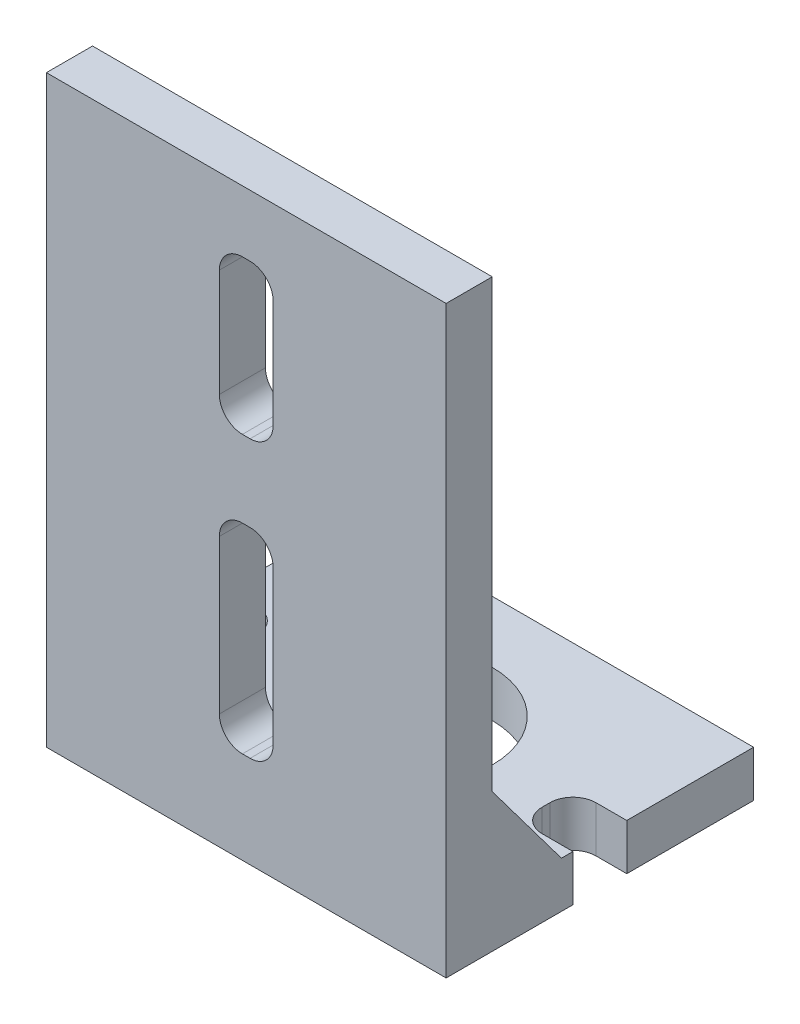
from build123d import *

# Parameters (mm, degrees)
ESBO_O1_W                = 26
ESBO_O1_H                = 20
RESSALTO_EXTRUS_O1_DEPTH = 3
ESBO_O2_W                = 26
ESBO_O2_H                = 3
RESSALTO_EXTRUS_O2_DEPTH = 35
ESBO_O3_W                = 3
ESBO_O3_H                = 4.5
RESSALTO_EXTRUS_O3_DEPTH = 6
CORTE_EXTRUS_O1_DEPTH    = 48.329507785
CORTE_EXTRUS_O2_REACH    = 49.836
ESBO_O5_W                = 3.5
ESBO_O5_H                = 10
ESBO_O5_H_2              = 13
FILETE2_R                = 1.5
FILETE3_R                = 1.5
FILETE4_R                = 1.5
CORTE_EXTRUS_O3_REACH    = 46.815
ESBO_O6_W                = 7
ESBO_O6_H                = 3.5
FILETE5_R                = 1.5
CORTE_EXTRUS_O4_REACH    = 46.815
ESBO_O7_R                = 5.5


with BuildPart() as part:
    # Esboço1 → Ressalto-extrusão1 (new body)
    with BuildSketch(Plane(origin=(0, 0, 0), x_dir=(1, 0, 0), z_dir=(0, 1, 0))):
        with Locations((8.077993659, -0.958207295)):
            Rectangle(ESBO_O1_W, ESBO_O1_H)
    extrude(amount=RESSALTO_EXTRUS_O1_DEPTH)

    # Esboço2 → Ressalto-extrusão2 (add)
    with BuildSketch(Plane(origin=(0, 3, 0), x_dir=(1, 0, 0), z_dir=(0, 1, 0))):
        with Locations((8.077993659, -9.458207295)):
            Rectangle(ESBO_O2_W, ESBO_O2_H)
    extrude(amount=RESSALTO_EXTRUS_O2_DEPTH)

    # Esboço3 → Ressalto-extrusão3 (add)
    with BuildSketch(Plane(origin=(0, 3, 0), x_dir=(1, 0, 0), z_dir=(0, 1, 0))):
        with Locations((19.577993659, -5.708207295)):
            Rectangle(ESBO_O3_W, ESBO_O3_H)
        with Locations((-3.422006341, -5.708207295)):
            Rectangle(ESBO_O3_W, ESBO_O3_H)
    extrude(amount=RESSALTO_EXTRUS_O3_DEPTH)

    # Esboço4 → Corte-extrusão1 (cut, through all)
    with BuildSketch(Plane.ZY.offset(4.922006341)):
        Polygon((3.458207295, 3), (7.958207295, 9), (3.458207295, 9), align=None)
    extrude(amount=-CORTE_EXTRUS_O1_DEPTH, mode=Mode.SUBTRACT)

    # Esboço5 → Corte-extrusão2 (cut, up to next)
    with BuildSketch(Plane.XY.offset(10.958207295), mode=Mode.PRIVATE) as corte_extrus_o2_sk1:
        with Locations((8.077993659, 29)):
            Rectangle(ESBO_O5_W, ESBO_O5_H)
    corte_extrus_o2_tool1 = extrude(corte_extrus_o2_sk1.sketch, amount=-CORTE_EXTRUS_O2_REACH, mode=Mode.PRIVATE) & part.part
    # Esboço5 → Corte-extrusão2 (cut, up to next)
    with BuildSketch(Plane.XY.offset(10.958207295), mode=Mode.PRIVATE) as corte_extrus_o2_sk2:
        with Locations((8.077993659, 12.5)):
            Rectangle(ESBO_O5_W, ESBO_O5_H_2)
    corte_extrus_o2_tool2 = extrude(corte_extrus_o2_sk2.sketch, amount=-CORTE_EXTRUS_O2_REACH, mode=Mode.PRIVATE) & part.part
    add(corte_extrus_o2_tool1.solids().sort_by_distance((8.077994, 29, 10.958207))[0], mode=Mode.SUBTRACT)
    add(corte_extrus_o2_tool2.solids().sort_by_distance((8.077994, 12.5, 10.958207))[0], mode=Mode.SUBTRACT)

    # Filete2
    filete2_edges = [part.edges().sort_by_distance(p)[0] for p in [
        (9.827993659, 34, 9.458207295),
        (6.327993659, 34, 9.458207295),
        (9.827993659, 24, 9.458207295),
        (6.327993659, 24, 9.458207295),
        (9.827993659, 19, 9.458207295),
        (6.327993659, 19, 9.458207295),
    ]]
    fillet(filete2_edges, radius=FILETE2_R)

    # Filete3
    filete3_edges = [part.edges().sort_by_distance(p)[0] for p in [
        (6.327993659, 6, 9.458207295),
    ]]
    fillet(filete3_edges, radius=FILETE3_R)

    # Filete4
    filete4_edges = [part.edges().sort_by_distance(p)[0] for p in [
        (9.827993659, 6, 9.458207295),
    ]]
    fillet(filete4_edges, radius=FILETE4_R)

    # Esboço6 → Corte-extrusão3 (cut, up to next)
    with BuildSketch(Plane.XZ, mode=Mode.PRIVATE) as corte_extrus_o3_sk1:
        with Locations((-4.922006341, 0.958207295)):
            Rectangle(ESBO_O6_W, ESBO_O6_H)
    corte_extrus_o3_tool1 = extrude(corte_extrus_o3_sk1.sketch, amount=-CORTE_EXTRUS_O3_REACH, mode=Mode.PRIVATE) & part.part
    # Esboço6 → Corte-extrusão3 (cut, up to next)
    with BuildSketch(Plane.XZ, mode=Mode.PRIVATE) as corte_extrus_o3_sk2:
        with Locations((21.077993659, 0.958207295)):
            Rectangle(ESBO_O6_W, ESBO_O6_H)
    corte_extrus_o3_tool2 = extrude(corte_extrus_o3_sk2.sketch, amount=-CORTE_EXTRUS_O3_REACH, mode=Mode.PRIVATE) & part.part
    add(corte_extrus_o3_tool1.solids().sort_by_distance((-4.922006, 0, 0.958207))[0], mode=Mode.SUBTRACT)
    add(corte_extrus_o3_tool2.solids().sort_by_distance((21.077994, 0, 0.958207))[0], mode=Mode.SUBTRACT)

    # Filete5
    filete5_edges = [part.edges().sort_by_distance(p)[0] for p in [
        (17.577993659, 1.5, -0.791792705),
        (17.577993659, 1.5, 2.708207295),
        (-1.422006341, 1.5, -0.791792705),
        (-1.422006341, 1.5, 2.708207295),
    ]]
    fillet(filete5_edges, radius=FILETE5_R)

    # Esboço7 → Corte-extrusão4 (cut, up to next)
    with BuildSketch(Plane.XZ, mode=Mode.PRIVATE) as corte_extrus_o4_sk1:
        with Locations((8.077993659, 0.458207295)):
            Circle(ESBO_O7_R)
    corte_extrus_o4_tool1 = extrude(corte_extrus_o4_sk1.sketch, amount=-CORTE_EXTRUS_O4_REACH, mode=Mode.PRIVATE) & part.part
    add(corte_extrus_o4_tool1.solids().sort_by_distance((8.077994, 0, 0.458207))[0], mode=Mode.SUBTRACT)


solid = part.part
